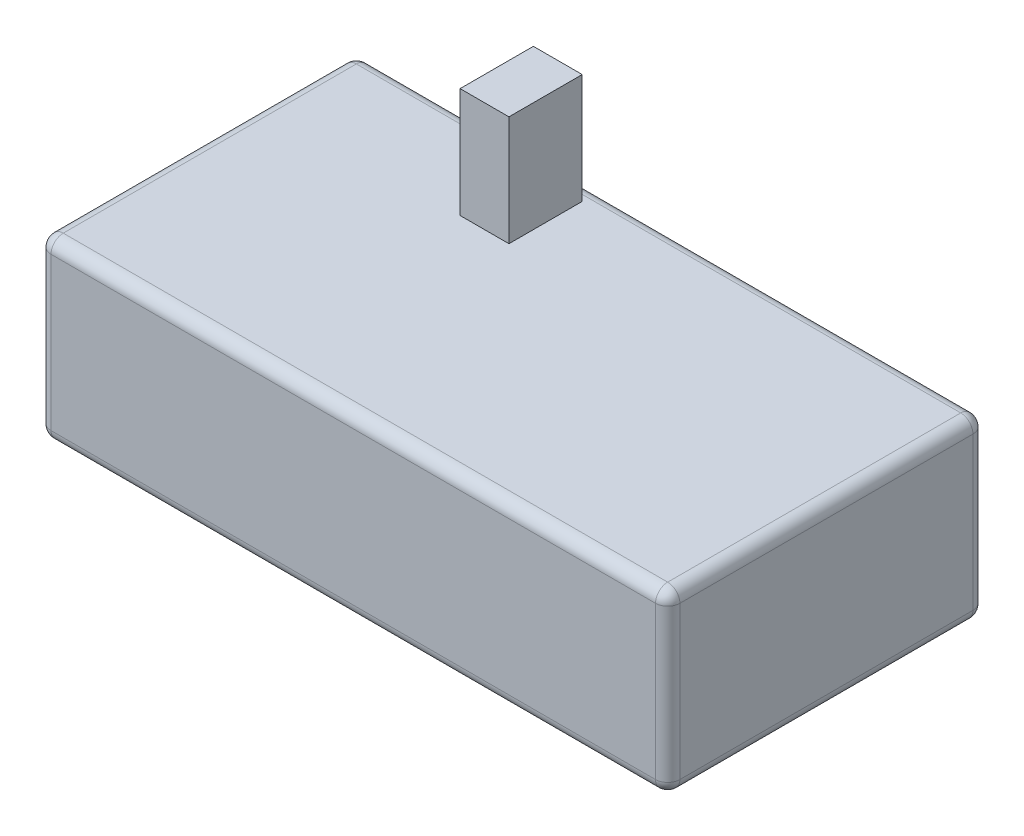
from build123d import *

# Parameters (mm, degrees)
SKETCH1_W           = 130.81
SKETCH1_H           = 66.04
BOSS_EXTRUDE1_DEPTH = 36.83
FILLET1_R           = 2.54
SKETCH2_W           = 10.16
SKETCH2_H           = 15.24
BOSS_EXTRUDE2_DEPTH = 22.86
SKETCH3_W           = 13
SKETCH3_H           = 4.064
BOSS_EXTRUDE3_DEPTH = 9.525
SKETCH4_W           = 4.872
SKETCH4_H           = 5.08
CUT_EXTRUDE1_DEPTH  = 92.445213926


with BuildPart() as part:
    # Sketch1 → Boss-Extrude1 (new body)
    with BuildSketch(Plane(origin=(0, 0, 0), x_dir=(1, 0, 0), z_dir=(0, 1, 0))):
        Rectangle(SKETCH1_W, SKETCH1_H)
    extrude(amount=BOSS_EXTRUDE1_DEPTH)

    # Fillet1
    fillet1_edges = [part.edges().sort_by_distance(p)[0] for p in [
        (65.405, 36.83, 0),
        (0, 36.83, -33.02),
        (-65.405, 36.83, 0),
        (0, 0, -33.02),
        (65.405, 0, 0),
        (0, 0, 33.02),
        (-65.405, 0, 0),
        (0, 36.83, 33.02),
        (-65.405, 18.415, -33.02),
        (65.405, 18.415, -33.02),
        (65.405, 18.415, 33.02),
        (-65.405, 18.415, 33.02),
    ]]
    fillet(fillet1_edges, radius=FILLET1_R)

    # Sketch2 → Boss-Extrude2 (add)
    with BuildSketch(Plane(origin=(0, 36.83, 0), x_dir=(1, 0, 0), z_dir=(0, 1, 0))):
        with Locations((-19.685, 21.59)):
            Rectangle(SKETCH2_W, SKETCH2_H)
    extrude(amount=BOSS_EXTRUDE2_DEPTH)

    # Sketch3 → Boss-Extrude3 (add)
    with BuildSketch(Plane(origin=(0, 0, -33.02), x_dir=(-1, 0, 0), z_dir=(0, 0, -1))):
        with Locations((5.905, 9.968)):
            Rectangle(SKETCH3_W, SKETCH3_H)
    extrude(amount=BOSS_EXTRUDE3_DEPTH)

    # Sketch4 → Cut-Extrude1 (cut, through all)
    with BuildSketch(Plane(origin=(0, 12, 0), x_dir=(1, 0, 0), z_dir=(0, 1, 0))):
        with Locations((-5.905, 37.973)):
            Rectangle(SKETCH4_W, SKETCH4_H)
    extrude(amount=-CUT_EXTRUDE1_DEPTH, mode=Mode.SUBTRACT)


solid = part.part
